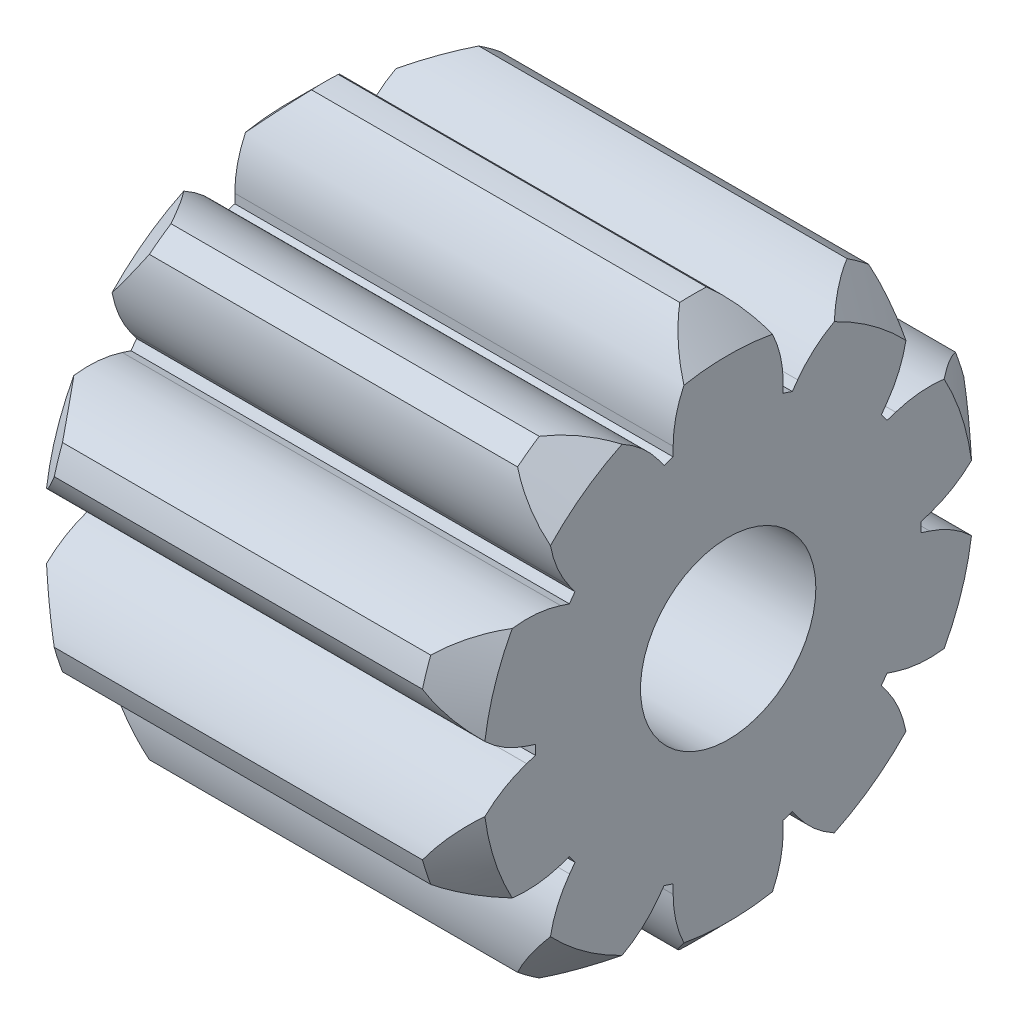
from build123d import *

# Parameters (mm, degrees)
SKETCH2_R           = 2.2
SKETCH2_R_2         = 1
BOSS_EXTRUDE2_DEPTH = 5
BOSS_EXTRUDE3_DEPTH = 5
CIRPATTERN1_COUNT   = 10


with BuildPart() as part:
    # Sketch2 → Boss-Extrude2 (new body)
    with BuildSketch(Plane(origin=(0, 0, 0), x_dir=(0, 0, -1), z_dir=(1, 0, 0))):
        Circle(SKETCH2_R)
        Circle(SKETCH2_R_2, mode=Mode.SUBTRACT)
    extrude(amount=BOSS_EXTRUDE2_DEPTH)


with BuildPart() as body_2:
    # Sketch3 → Boss-Extrude3 (new body)
    with BuildSketch(Plane(origin=(0, 0, 0), x_dir=(0, 0, -1), z_dir=(1, 0, 0))):
        with BuildLine():
            ThreePointArc((-0.627770898, 2.108531171), (0, 2.2), (0.627770898, 2.108531171))
            Line((0.627770898, 2.108531171), (0.627770898, 2.212668909))
            ThreePointArc((0.627770898, 2.212668909), (0.502708566, 2.758930187), (0.15243605, 3.196367196))
            ThreePointArc((0.15243605, 3.196367196), (0, 3.2), (-0.15243605, 3.196367196))
            ThreePointArc((-0.15243605, 3.196367196), (-0.502708566, 2.758930187), (-0.627770898, 2.212668909))
            Line((-0.627770898, 2.212668909), (-0.627770898, 2.108531171))
        make_face()
    extrude(amount=BOSS_EXTRUDE3_DEPTH)


with BuildPart() as cirpattern1_1:
    # CirPattern1: pattern copy
    add(body_2.part.rotate(Axis((0, 0, 0), (1, 0, 0)), 1 * 360 / CIRPATTERN1_COUNT))


with BuildPart() as cirpattern1_2:
    # CirPattern1: pattern copy
    add(body_2.part.rotate(Axis((0, 0, 0), (1, 0, 0)), 2 * 360 / CIRPATTERN1_COUNT))


with BuildPart() as cirpattern1_3:
    # CirPattern1: pattern copy
    add(body_2.part.rotate(Axis((0, 0, 0), (1, 0, 0)), 3 * 360 / CIRPATTERN1_COUNT))


with BuildPart() as cirpattern1_4:
    # CirPattern1: pattern copy
    add(body_2.part.rotate(Axis((0, 0, 0), (1, 0, 0)), 4 * 360 / CIRPATTERN1_COUNT))


with BuildPart() as cirpattern1_5:
    # CirPattern1: pattern copy
    add(body_2.part.rotate(Axis((0, 0, 0), (1, 0, 0)), 5 * 360 / CIRPATTERN1_COUNT))


with BuildPart() as cirpattern1_6:
    # CirPattern1: pattern copy
    add(body_2.part.rotate(Axis((0, 0, 0), (1, 0, 0)), 6 * 360 / CIRPATTERN1_COUNT))


with BuildPart() as cirpattern1_7:
    # CirPattern1: pattern copy
    add(body_2.part.rotate(Axis((0, 0, 0), (1, 0, 0)), 7 * 360 / CIRPATTERN1_COUNT))


with BuildPart() as cirpattern1_8:
    # CirPattern1: pattern copy
    add(body_2.part.rotate(Axis((0, 0, 0), (1, 0, 0)), 8 * 360 / CIRPATTERN1_COUNT))


with BuildPart() as cirpattern1_9:
    # CirPattern1: pattern copy
    add(body_2.part.rotate(Axis((0, 0, 0), (1, 0, 0)), 9 * 360 / CIRPATTERN1_COUNT))


with BuildPart() as body_2_1:
    add(body_2.part)

    # Combine1: union CirPattern1_7, CirPattern1_6, CirPattern1_4, CirPattern1_3, part, CirPattern1_1, CirPattern1_2, CirPattern1_5, CirPattern1_8, CirPattern1_9
    add(cirpattern1_7.part)
    add(cirpattern1_6.part)
    add(cirpattern1_4.part)
    add(cirpattern1_3.part)
    add(part.part)
    add(cirpattern1_1.part)
    add(cirpattern1_2.part)
    add(cirpattern1_5.part)
    add(cirpattern1_8.part)
    add(cirpattern1_9.part)

    # Sketch4 → Cut-Revolve1 (revolve, cut)
    with BuildSketch(Plane.XY):
        Polygon((0, 0), (0, 2.8), (0.4, 3.2), (4.6, 3.2), (5, 2.8), (5, 0), (6, 0), (6, 4.2), (-1, 4.2), (-1, 0), align=None)
    revolve(axis=Axis((6, 0, 0), (-1, 0, 0)), mode=Mode.SUBTRACT)


solid = body_2_1.part
